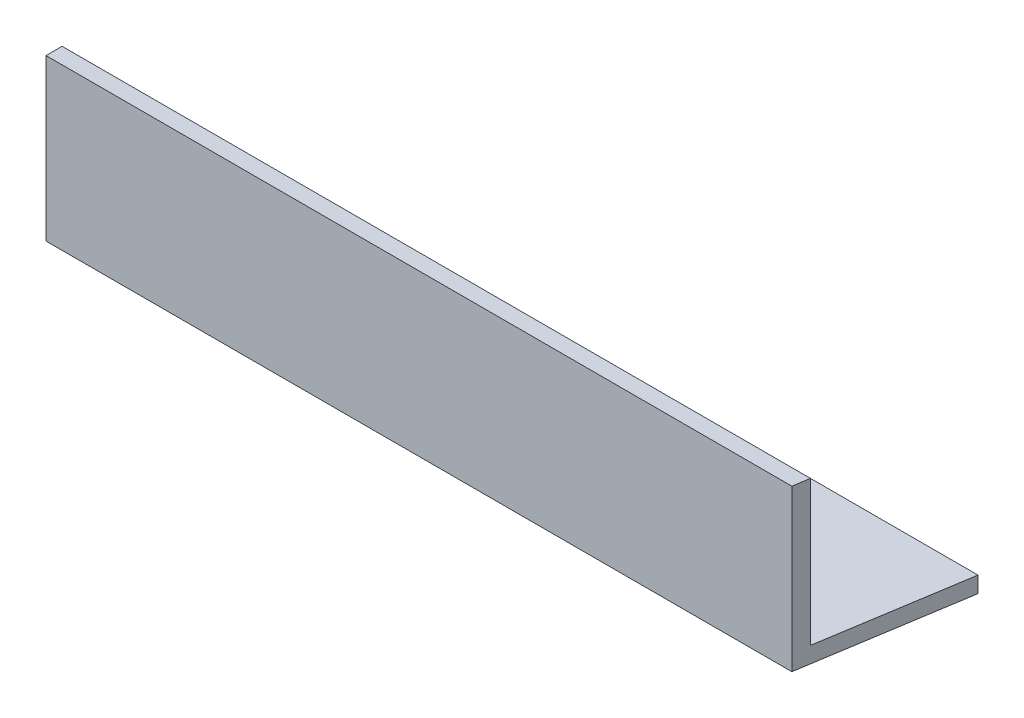
from build123d import *

# Parameters (mm, degrees)
BOSS_EXTRUDE1_DEPTH = 96
CUT_EXTRUDE1_DEPTH  = 101.079968026


with BuildPart() as part:
    # Sketch1 → Boss-Extrude1 (new body)
    with BuildSketch(Plane(origin=(0, 0, 0), x_dir=(0, 0, -1), z_dir=(1, 0, 0))):
        Polygon((0, 20), (0, 0), (20, 0), (20, 2), (2, 2), (2, 20), align=None)
    extrude(amount=BOSS_EXTRUDE1_DEPTH)

    # Sketch2 → Cut-Extrude1 (cut, through all)
    with BuildSketch(Plane(origin=(0, 0, 0), x_dir=(1, 0, 0), z_dir=(0, 1, 0))):
        Polygon((96, 20), (92.832311194, 0), (96, 0), align=None)
    extrude(amount=CUT_EXTRUDE1_DEPTH, mode=Mode.SUBTRACT)


solid = part.part
